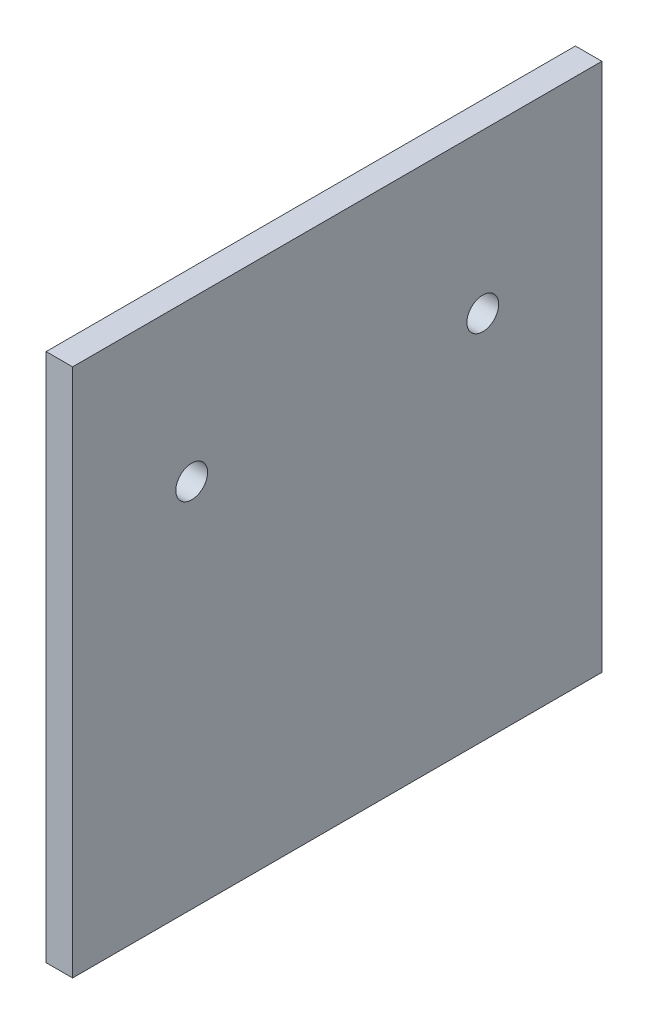
from build123d import *

# Parameters (mm, degrees)
SKETCH1_W           = 200
SKETCH1_H           = 200
BOSS_EXTRUDE1_DEPTH = 10
CUT_EXTRUDE1_REACH  = 143.774
SKETCH2_R           = 6


with BuildPart() as part:
    # Sketch1 → Boss-Extrude1 (new body)
    with BuildSketch(Plane(origin=(0, 0, 0), x_dir=(0, 0, -1), z_dir=(1, 0, 0))):
        Rectangle(SKETCH1_W, SKETCH1_H)
    extrude(amount=BOSS_EXTRUDE1_DEPTH)

    # Sketch2 → Cut-Extrude1 (cut, up to next)
    with BuildSketch(Plane(origin=(10, 0, 0), x_dir=(0, 0, -1), z_dir=(1, 0, 0)), mode=Mode.PRIVATE) as cut_extrude1_sk1:
        with Locations((-55, 40)):
            Circle(SKETCH2_R)
    cut_extrude1_tool1 = extrude(cut_extrude1_sk1.sketch, amount=-CUT_EXTRUDE1_REACH, mode=Mode.PRIVATE) & part.part
    # Sketch2 → Cut-Extrude1 (cut, up to next)
    with BuildSketch(Plane(origin=(10, 0, 0), x_dir=(0, 0, -1), z_dir=(1, 0, 0)), mode=Mode.PRIVATE) as cut_extrude1_sk2:
        with Locations((55, 40)):
            Circle(SKETCH2_R)
    cut_extrude1_tool2 = extrude(cut_extrude1_sk2.sketch, amount=-CUT_EXTRUDE1_REACH, mode=Mode.PRIVATE) & part.part
    add(cut_extrude1_tool1.solids().sort_by_distance((10, 40, 55))[0], mode=Mode.SUBTRACT)
    add(cut_extrude1_tool2.solids().sort_by_distance((10, 40, -55))[0], mode=Mode.SUBTRACT)


solid = part.part
